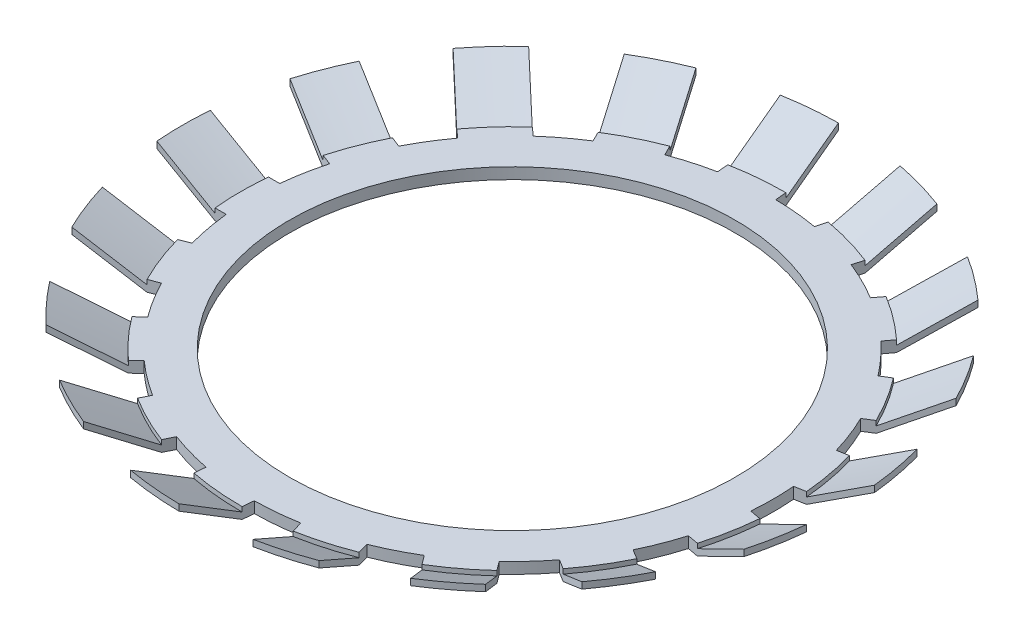
from build123d import *

# Parameters (mm, degrees)
SKETCH1_R           = 30.5
SKETCH1_R_2         = 25
BOSS_EXTRUDE1_DEPTH = 1.25
SKETCH2_R           = 30.5
BOSS_EXTRUDE2_DEPTH = 30
BOSS_EXTRUDE2_DRAFT = -60
SKETCH3_R           = 29.25
CUT_EXTRUDE1_DEPTH  = 30
CUT_EXTRUDE1_DRAFT  = 60
SKETCH4_R           = 94.674694241
SKETCH4_R_2         = 37
CUT_EXTRUDE2_DEPTH  = 30
SKETCH7_R           = 30.5
SKETCH7_R_2         = 25
BOSS_EXTRUDE4_DEPTH = 1.25
CUT_EXTRUDE3_DEPTH  = 30


with BuildPart() as part:
    # Sketch1 → Boss-Extrude1 (new body)
    with BuildSketch(Plane(origin=(0, 0, 0), x_dir=(1, 0, 0), z_dir=(0, 1, 0))):
        with Locations(Location((0, 0, 0), (0, 0, 270))):
            Circle(SKETCH1_R)
        with Locations(Location((0, 0, 0), (0, 0, 270))):
            Circle(SKETCH1_R_2, mode=Mode.SUBTRACT)
    extrude(amount=BOSS_EXTRUDE1_DEPTH)


with BuildPart() as boss_extrude2_tool:
    # Sketch2 → Boss-Extrude2 (with draft: the straight prism first)
    with BuildSketch(Plane(origin=(0, 0, 0), x_dir=(1, 0, 0), z_dir=(0, 1, 0))):
        Circle(SKETCH2_R)
    extrude(amount=BOSS_EXTRUDE2_DEPTH)
    # Boss-Extrude2: the draft: its side faces are tilted about the plane it starts from
    boss_extrude2_sides = [boss_extrude2_tool.faces().sort_by_distance(p)[0] for p in [
        (-30.5, 15, 0),
    ]]
    draft(boss_extrude2_sides, Plane(origin=(0, 0, 0), x_dir=(1, 0, 0), z_dir=(0, 1, 0)), BOSS_EXTRUDE2_DRAFT)


with BuildPart() as part_1:
    add(part.part)

    # Boss-Extrude2: add boss_extrude2_tool
    add(boss_extrude2_tool.part)


with BuildPart() as cut_extrude1_tool:
    # Sketch3 → Cut-Extrude1 (with draft: the straight prism first)
    with BuildSketch(Plane.XZ):
        Circle(SKETCH3_R)
    extrude(amount=-CUT_EXTRUDE1_DEPTH)
    # Cut-Extrude1: the draft: its side faces are tilted about the plane it starts from
    cut_extrude1_sides = [cut_extrude1_tool.faces().sort_by_distance(p)[0] for p in [
        (-29.25, 15, 0),
    ]]
    draft(cut_extrude1_sides, Plane.XZ, CUT_EXTRUDE1_DRAFT)


with BuildPart() as part_2:
    add(part_1.part)

    # Cut-Extrude1: cut by cut_extrude1_tool
    add(cut_extrude1_tool.part, mode=Mode.SUBTRACT)

    # Sketch4 → Cut-Extrude2 (cut)
    with BuildSketch(Plane(origin=(0, 0, 0), x_dir=(1, 0, 0), z_dir=(0, 1, 0))):
        Circle(SKETCH4_R)
        with Locations(Location((0, 0, 0), (0, 0, 270))):
            Circle(SKETCH4_R_2, mode=Mode.SUBTRACT)
    extrude(amount=CUT_EXTRUDE2_DEPTH, mode=Mode.SUBTRACT)

    # Sketch7 → Boss-Extrude4 (add)
    with BuildSketch(Plane(origin=(0, 0, 0), x_dir=(1, 0, 0), z_dir=(0, 1, 0))):
        with Locations(Location((0, 0, 0), (0, 0, 270))):
            Circle(SKETCH7_R)
        with Locations(Location((0, 0, 0), (0, 0, 270))):
            Circle(SKETCH7_R_2, mode=Mode.SUBTRACT)
    extrude(amount=BOSS_EXTRUDE4_DEPTH)

    # Sketch5 → Cut-Extrude3 (cut)
    with BuildSketch(Plane(origin=(0, 0, 0), x_dir=(1, 0, 0), z_dir=(0, 1, 0))):
        with BuildLine():
            Line((-36.878177829, 3), (-29.095747112, 3))
            ThreePointArc((-29.095747112, 3), (-28.751963166, 5.374673396), (-28.214701174, 7.713179477))
            Line((-28.214701174, 7.713179477), (-35.471601695, 10.524517717))
            ThreePointArc((-35.471601695, 10.524517717), (-36.370004688, 6.798732159), (-36.878177829, 3))
        make_face()
        with BuildLine():
            Line((-33.304151698, 16.119351093), (-26.047251177, 13.308012854))
            ThreePointArc((-26.047251177, 13.308012854), (-24.86885122, 15.398140764), (-23.5231035, 17.384651326))
            Line((-23.5231035, 17.384651326), (-29.274389198, 22.627640997))
            ThreePointArc((-29.274389198, 22.627640997), (-31.458034022, 19.477990026), (-33.304151698, 16.119351093))
        make_face()
        with BuildLine():
            Line((-25.232215336, 27.061694501), (-19.480929638, 21.81870483))
            ThreePointArc((-19.480929638, 21.81870483), (-17.627063114, 23.342003898), (-15.654580352, 24.708229682))
            Line((-15.654580352, 24.708229682), (-19.123508224, 31.674775977))
            ThreePointArc((-19.123508224, 31.674775977), (-22.297481546, 29.526637409), (-25.232215336, 27.061694501))
        make_face()
        with BuildLine():
            Line((-13.752528476, 34.349206112), (-10.283600604, 27.382659816))
            ThreePointArc((-10.283600604, 27.382659816), (-8.00464246, 28.133400063), (-5.671819382, 28.694824706))
            Line((-5.671819382, 28.694824706), (-6.389891497, 36.444056946))
            ThreePointArc((-6.389891497, 36.444056946), (-10.125530633, 35.587548797), (-13.752528476, 34.349206112))
        make_face()
        with BuildLine():
            Line((-0.415486439, 36.997667102), (0.302585676, 29.248434863))
            ThreePointArc((0.302585676, 29.248434863), (2.698849514, 29.125224657), (5.076952224, 28.80602465))
            Line((5.076952224, 28.80602465), (7.206715484, 36.29136608))
            ThreePointArc((7.206715484, 36.29136608), (3.4139293, 36.842164523), (-0.415486439, 36.997667102))
        make_face()
        with BuildLine():
            Line((12.977669343, 34.649388139), (10.847906083, 27.164046709))
            ThreePointArc((10.847906083, 27.164046709), (13.037846906, 26.183526272), (15.140053299, 25.026811345))
            Line((15.140053299, 25.026811345), (19.830015605, 31.237325128))
            ThreePointArc((19.830015605, 31.237325128), (16.492319164, 33.12104178), (12.977669343, 34.649388139))
        make_face()
        with BuildLine():
            Line((24.618118968, 27.621517309), (19.928156663, 21.411003527))
            ThreePointArc((19.928156663, 21.411003527), (21.616010829, 19.705597577), (23.158406283, 17.86758849))
            Line((23.158406283, 17.86758849), (29.775162236, 21.964510325))
            ThreePointArc((29.775162236, 21.964510325), (27.343329937, 24.926738815), (24.618118968, 27.621517309))
        make_face()
        with BuildLine():
            Line((32.933755213, 16.86320751), (26.31699926, 12.766285675))
            ThreePointArc((26.31699926, 12.766285675), (27.27481271, 10.566318736), (28.049088173, 8.295248801))
            Line((28.049088173, 8.295248801), (35.699008218, 9.725266693))
            ThreePointArc((35.699008218, 9.725266693), (34.501472488, 13.365941649), (32.933755213, 16.86320751))
        make_face()
        with BuildLine():
            ThreePointArc((29.25, 0), (29.225385963, -1.199714668), (29.15158528, -2.397410203))
            Line((29.15158528, -2.397410203), (36.801505325, -3.827428095))
            ThreePointArc((36.801505325, -3.827428095), (36.950343009, -1.916285858), (37, 0))
            ThreePointArc((37, 0), (36.950343009, 1.916285858), (36.801505325, 3.827428095))
            Line((36.801505325, 3.827428095), (29.15158528, 2.397410203))
            ThreePointArc((29.15158528, 2.397410203), (29.225385963, 1.199714668), (29.25, 0))
        make_face()
        with BuildLine():
            ThreePointArc((28.049088173, -8.295248801), (27.27481271, -10.566318736), (26.31699926, -12.766285675))
            Line((26.31699926, -12.766285675), (32.933755213, -16.86320751))
            ThreePointArc((32.933755213, -16.86320751), (34.501472488, -13.365941649), (35.699008218, -9.725266693))
            Line((35.699008218, -9.725266693), (28.049088173, -8.295248801))
        make_face()
        with BuildLine():
            ThreePointArc((23.158406283, -17.86758849), (21.616010829, -19.705597577), (19.928156663, -21.411003527))
            Line((19.928156663, -21.411003527), (24.618118968, -27.621517309))
            ThreePointArc((24.618118968, -27.621517309), (27.343329937, -24.926738815), (29.775162236, -21.964510325))
            Line((29.775162236, -21.964510325), (23.158406283, -17.86758849))
        make_face()
        with BuildLine():
            ThreePointArc((15.140053299, -25.026811345), (13.037846906, -26.183526272), (10.847906083, -27.164046709))
            Line((10.847906083, -27.164046709), (12.977669343, -34.649388139))
            ThreePointArc((12.977669343, -34.649388139), (16.492319164, -33.12104178), (19.830015605, -31.237325128))
            Line((19.830015605, -31.237325128), (15.140053299, -25.026811345))
        make_face()
        with BuildLine():
            ThreePointArc((5.076952224, -28.80602465), (2.698849514, -29.125224657), (0.302585676, -29.248434863))
            Line((0.302585676, -29.248434863), (-0.415486439, -36.997667102))
            ThreePointArc((-0.415486439, -36.997667102), (3.4139293, -36.842164523), (7.206715484, -36.29136608))
            Line((7.206715484, -36.29136608), (5.076952224, -28.80602465))
        make_face()
        with BuildLine():
            ThreePointArc((-5.671819382, -28.694824706), (-8.00464246, -28.133400063), (-10.283600604, -27.382659816))
            Line((-10.283600604, -27.382659816), (-13.752528476, -34.349206112))
            ThreePointArc((-13.752528476, -34.349206112), (-10.125530633, -35.587548797), (-6.389891497, -36.444056946))
            Line((-6.389891497, -36.444056946), (-5.671819382, -28.694824706))
        make_face()
        with BuildLine():
            ThreePointArc((-28.214701174, -7.713179477), (-28.751963166, -5.374673396), (-29.095747112, -3))
            Line((-29.095747112, -3), (-36.878177829, -3))
            ThreePointArc((-36.878177829, -3), (-36.370004688, -6.798732159), (-35.471601695, -10.524517717))
            Line((-35.471601695, -10.524517717), (-28.214701174, -7.713179477))
        make_face()
        with BuildLine():
            ThreePointArc((-23.5231035, -17.384651326), (-24.86885122, -15.398140764), (-26.047251177, -13.308012854))
            Line((-26.047251177, -13.308012854), (-33.304151698, -16.119351093))
            ThreePointArc((-33.304151698, -16.119351093), (-31.458034022, -19.477990026), (-29.274389198, -22.627640997))
            Line((-29.274389198, -22.627640997), (-23.5231035, -17.384651326))
        make_face()
        with BuildLine():
            ThreePointArc((-15.654580352, -24.708229682), (-17.627063114, -23.342003898), (-19.480929638, -21.81870483))
            Line((-19.480929638, -21.81870483), (-25.232215336, -27.061694501))
            ThreePointArc((-25.232215336, -27.061694501), (-22.297481546, -29.526637409), (-19.123508224, -31.674775977))
            Line((-19.123508224, -31.674775977), (-15.654580352, -24.708229682))
        make_face()
    extrude(amount=CUT_EXTRUDE3_DEPTH, mode=Mode.SUBTRACT)


solid = part_2.part
